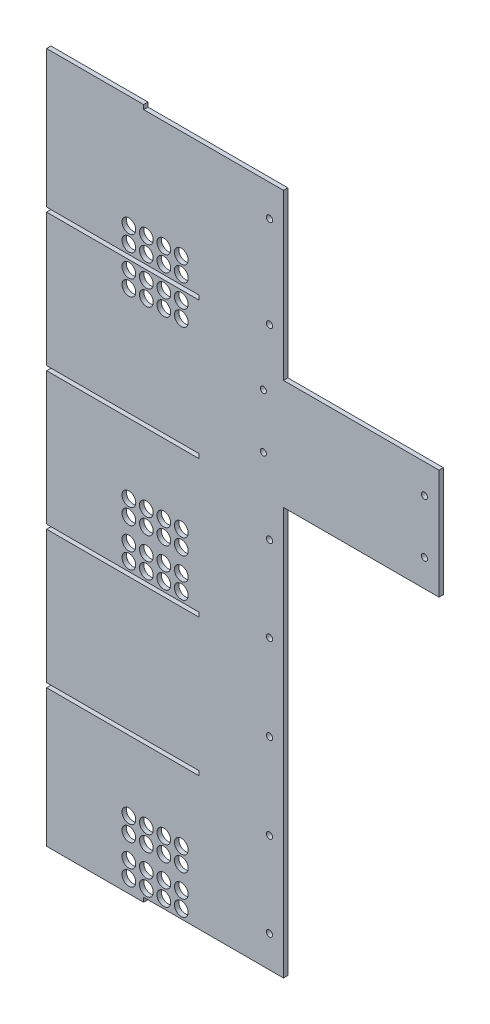
from build123d import *

# Parameters (mm, degrees)
BOSS_EXTRUDE2_DEPTH = 3.175
BOSS_EXTRUDE3_DEPTH = 3.175
SKETCH11_W          = 113.03
SKETCH11_H          = 79.94142
BOSS_EXTRUDE8_DEPTH = 3.175
SKETCH12_W          = 70.49262
SKETCH12_H          = 3.175
BOSS_EXTRUDE9_DEPTH = 3.175
SKETCH15_R          = 2.25
CUT_EXTRUDE1_DEPTH  = 371.49176257
SKETCH16_R          = 2.250000072
SKETCH16_R_2        = 2.25
CUT_EXTRUDE2_DEPTH  = 371.49176257
SKETCH17_R          = 5
CUT_EXTRUDE3_DEPTH  = 371.49176257


with BuildPart() as part:
    # Sketch1 → Boss-Extrude2 (new body)
    with BuildSketch(Plane.XY):
        Polygon((129.013076168, 254.245404572), (-18.685383832, 254.245404572), (-18.685383832, 157.666984572), (92.088461168, 157.666984572), (92.088461168, 154.491984572), (-18.685383832, 154.491984572), (-18.685383832, 57.913564572), (92.088461168, 57.913564572), (92.088461168, 54.738564572), (-18.685383832, 54.738564572), (-18.685383832, -41.839855428), (92.088461168, -41.839855428), (92.088461168, -45.014855428), (-18.685383832, -45.014855428), (-18.685383832, -141.593275428), (92.088461168, -141.593275428), (92.088461168, -144.768275428), (-18.685383832, -144.768275428), (-18.685383832, -241.346695428), (129.013076168, -241.346695428), align=None)
    extrude(amount=BOSS_EXTRUDE2_DEPTH)

    # Sketch4 → Boss-Extrude3 (add, through all)
    with BuildSketch(Plane.XY.offset(3.175)):
        Polygon((129.013076168, 254.245404572), (129.013076168, -241.346695428), (153.407236168, -241.346695428), (153.407236168, -227.262720585), (153.407236168, 240.16142973), (153.407236168, 254.245404572), align=None)
    extrude(amount=-BOSS_EXTRUDE3_DEPTH)

    # Sketch11 → Boss-Extrude8 (add, through all)
    with BuildSketch(Plane.XY.offset(3.175)):
        with Locations((209.922236168, 94.709274572)):
            Rectangle(SKETCH11_W, SKETCH11_H)
    extrude(amount=-BOSS_EXTRUDE8_DEPTH)

    # Sketch12 → Boss-Extrude9 (add, through all)
    with BuildSketch(Plane(origin=(0, 0, 0), x_dir=(-1, 0, 0), z_dir=(0, 0, -1))):
        with Locations((-16.560926168, 255.832904572)):
            Rectangle(SKETCH12_W, SKETCH12_H)
        with Locations((-16.560926168, -242.934195428)):
            Rectangle(SKETCH12_W, SKETCH12_H)
    extrude(amount=-BOSS_EXTRUDE9_DEPTH)

    # Sketch15 → Cut-Extrude1 (cut, through all)
    with BuildSketch(Plane.XY.offset(3.175)):
        with Locations((143.247236168, 231.313297791)):
            Circle(SKETCH15_R)
        with Locations((143.247236168, 164.651984572)):
            Circle(SKETCH15_R)
        with Locations((255.799716168, 113.343984572)):
            Circle(SKETCH15_R)
        with Locations((255.799716168, 74.495671354)):
            Circle(SKETCH15_R)
        with Locations((143.247236168, 29.338564572)):
            Circle(SKETCH15_R)
        with Locations((143.247236168, -32.334232694)):
            Circle(SKETCH15_R)
        with Locations((143.247236168, -94.538012037)):
            Circle(SKETCH15_R)
        with Locations((143.247236168, -156.74179138)):
            Circle(SKETCH15_R)
        with Locations((143.247236168, -218.414588646)):
            Circle(SKETCH15_R)
    extrude(amount=-CUT_EXTRUDE1_DEPTH, mode=Mode.SUBTRACT)

    # Sketch16 → Cut-Extrude2 (cut, through all)
    with BuildSketch(Plane.XY.offset(3.175)):
        with Locations((138.792076168, 121.451235566)):
            Circle(SKETCH16_R)
        with Locations((138.792076168, 82.140925566)):
            Circle(SKETCH16_R_2)
    extrude(amount=-CUT_EXTRUDE2_DEPTH, mode=Mode.SUBTRACT)

    # Sketch17 → Cut-Extrude3 (cut, through all)
    with BuildSketch(Plane.XY.offset(3.175)):
        with Locations((79.191467271, 4.016944877)):
            Circle(SKETCH17_R)
        with Locations((66.491467271, 4.016944877)):
            Circle(SKETCH17_R)
        with Locations((53.791467271, 4.016944877)):
            Circle(SKETCH17_R)
        with Locations((41.091467271, 4.016944877)):
            Circle(SKETCH17_R)
        with Locations((66.491467271, -7.413055123)):
            Circle(SKETCH17_R)
        with Locations((53.791467271, -7.413055123)):
            Circle(SKETCH17_R)
        with Locations((41.091467271, -7.413055123)):
            Circle(SKETCH17_R)
        with Locations((79.191467271, -7.413055123)):
            Circle(SKETCH17_R)
        with Locations(Location((41.091467271, -35.281788831, 0), (0, 0, 180))):
            Circle(SKETCH17_R)
        with Locations(Location((41.091467271, -23.851788831, 0), (0, 0, 180))):
            Circle(SKETCH17_R)
        with Locations(Location((53.791467271, -35.281788831, 0), (0, 0, 180))):
            Circle(SKETCH17_R)
        with Locations(Location((53.791467271, -23.851788831, 0), (0, 0, 180))):
            Circle(SKETCH17_R)
        with Locations(Location((66.491467271, -35.281788831, 0), (0, 0, 180))):
            Circle(SKETCH17_R)
        with Locations(Location((66.491467271, -23.851788831, 0), (0, 0, 180))):
            Circle(SKETCH17_R)
        with Locations(Location((79.191467271, -23.851788831, 0), (0, 0, 180))):
            Circle(SKETCH17_R)
        with Locations(Location((79.191467271, -35.281788831, 0), (0, 0, 180))):
            Circle(SKETCH17_R)
        with Locations((79.191467271, -195.489895123)):
            Circle(SKETCH17_R)
        with Locations((66.491467271, -195.489895123)):
            Circle(SKETCH17_R)
        with Locations((53.791467271, -195.489895123)):
            Circle(SKETCH17_R)
        with Locations((41.091467271, -195.489895123)):
            Circle(SKETCH17_R)
        with Locations((66.491467271, -206.919895123)):
            Circle(SKETCH17_R)
        with Locations((53.791467271, -206.919895123)):
            Circle(SKETCH17_R)
        with Locations((41.091467271, -206.919895123)):
            Circle(SKETCH17_R)
        with Locations((79.191467271, -206.919895123)):
            Circle(SKETCH17_R)
        with Locations(Location((41.091467271, -234.788628831, 0), (0, 0, 180))):
            Circle(SKETCH17_R)
        with Locations(Location((41.091467271, -223.358628831, 0), (0, 0, 180))):
            Circle(SKETCH17_R)
        with Locations(Location((53.791467271, -234.788628831, 0), (0, 0, 180))):
            Circle(SKETCH17_R)
        with Locations(Location((53.791467271, -223.358628831, 0), (0, 0, 180))):
            Circle(SKETCH17_R)
        with Locations(Location((66.491467271, -234.788628831, 0), (0, 0, 180))):
            Circle(SKETCH17_R)
        with Locations(Location((66.491467271, -223.358628831, 0), (0, 0, 180))):
            Circle(SKETCH17_R)
        with Locations(Location((79.191467271, -223.358628831, 0), (0, 0, 180))):
            Circle(SKETCH17_R)
        with Locations(Location((79.191467271, -234.788628831, 0), (0, 0, 180))):
            Circle(SKETCH17_R)
        with Locations((79.191467271, 175.728851427)):
            Circle(SKETCH17_R)
        with Locations((66.491467271, 175.728851427)):
            Circle(SKETCH17_R)
        with Locations((53.791467271, 175.728851427)):
            Circle(SKETCH17_R)
        with Locations((41.091467271, 175.728851427)):
            Circle(SKETCH17_R)
        with Locations((66.491467271, 164.298851427)):
            Circle(SKETCH17_R)
        with Locations((53.791467271, 164.298851427)):
            Circle(SKETCH17_R)
        with Locations((41.091467271, 164.298851427)):
            Circle(SKETCH17_R)
        with Locations((79.191467271, 164.298851427)):
            Circle(SKETCH17_R)
        with Locations(Location((41.091467271, 136.430117718, 0), (0, 0, 180))):
            Circle(SKETCH17_R)
        with Locations(Location((41.091467271, 147.860117718, 0), (0, 0, 180))):
            Circle(SKETCH17_R)
        with Locations(Location((53.791467271, 136.430117718, 0), (0, 0, 180))):
            Circle(SKETCH17_R)
        with Locations(Location((53.791467271, 147.860117718, 0), (0, 0, 180))):
            Circle(SKETCH17_R)
        with Locations(Location((66.491467271, 136.430117718, 0), (0, 0, 180))):
            Circle(SKETCH17_R)
        with Locations(Location((66.491467271, 147.860117718, 0), (0, 0, 180))):
            Circle(SKETCH17_R)
        with Locations(Location((79.191467271, 147.860117718, 0), (0, 0, 180))):
            Circle(SKETCH17_R)
        with Locations(Location((79.191467271, 136.430117718, 0), (0, 0, 180))):
            Circle(SKETCH17_R)
    extrude(amount=-CUT_EXTRUDE3_DEPTH, mode=Mode.SUBTRACT)


solid = part.part
